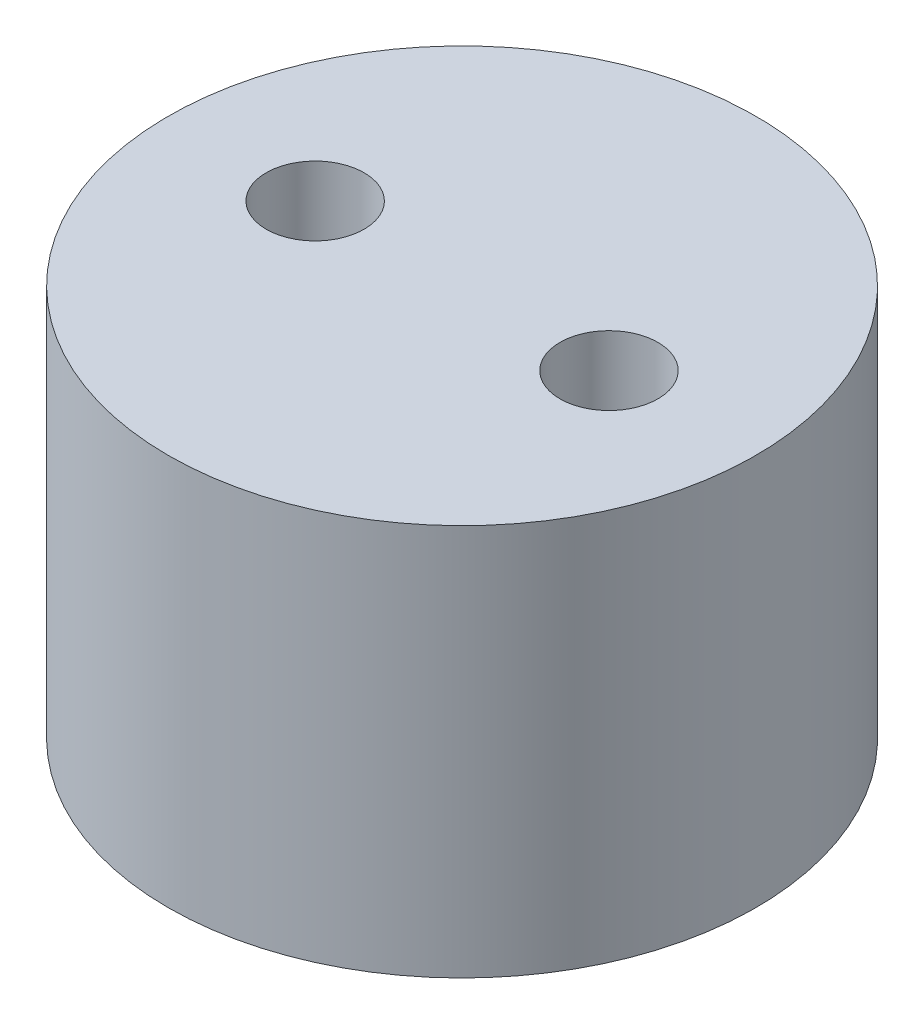
from build123d import *

# Parameters (mm, degrees)
SKETCH1_R           = 15
SKETCH1_R_2         = 2.5
BOSS_EXTRUDE1_DEPTH = 20


with BuildPart() as part:
    # Sketch1 → Boss-Extrude1 (new body)
    with BuildSketch(Plane(origin=(0, 0, 0), x_dir=(1, 0, 0), z_dir=(0, 1, 0))):
        with Locations(Location((0, 0, 0), (0, 0, 270))):
            Circle(SKETCH1_R)
        with Locations(Location((-7.5, 0, 0), (0, 0, 270))):
            Circle(SKETCH1_R_2, mode=Mode.SUBTRACT)
        with Locations(Location((7.5, 0, 0), (0, 0, 270))):
            Circle(SKETCH1_R_2, mode=Mode.SUBTRACT)
    extrude(amount=BOSS_EXTRUDE1_DEPTH)


solid = part.part
